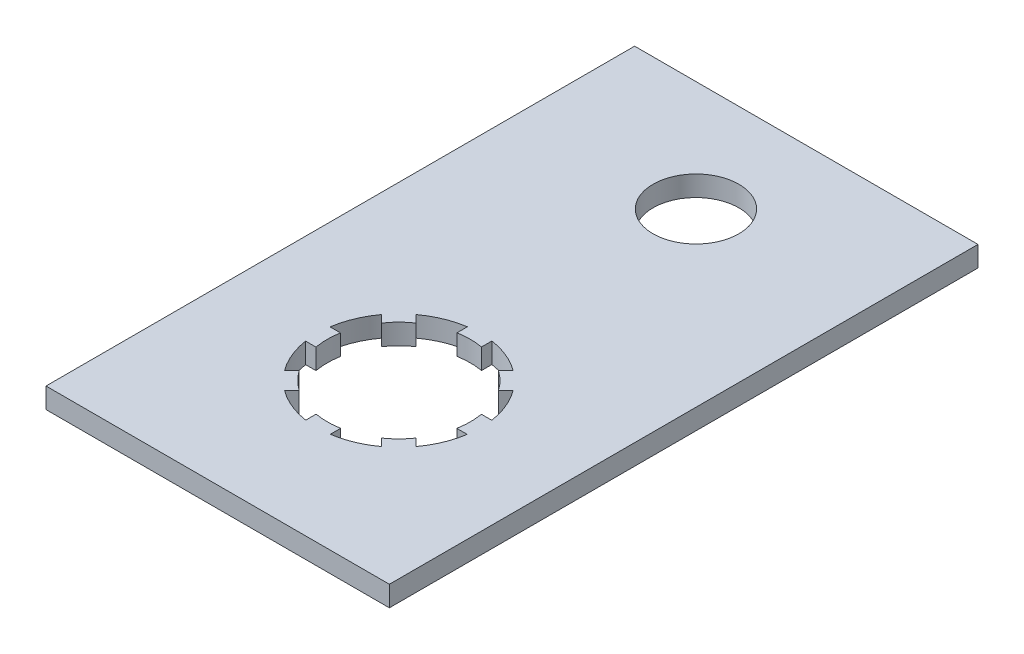
from build123d import *

# Parameters (mm, degrees)
SKETCH1_W           = 21.336
SKETCH1_H           = 36.576
SKETCH1_R           = 2.667
BOSS_EXTRUDE1_DEPTH = 1.27


with BuildPart() as part:
    # Sketch1 → Boss-Extrude1 (new body)
    with BuildSketch(Plane(origin=(0, 0, 0), x_dir=(1, 0, 0), z_dir=(0, 1, 0))):
        Rectangle(SKETCH1_W, SKETCH1_H)
        with BuildLine():
            Line((3.018435283, -2.946661255), (2.56364651, -3.401450028))
            ThreePointArc((2.56364651, -3.401450028), (2.768236135, -3.554896302), (2.963662393, -3.719854635))
            ThreePointArc((2.963662393, -3.719854635), (3.148123637, -3.8946201), (3.322296862, -4.079640655))
            ThreePointArc((3.322296862, -4.079640655), (3.486686927, -4.275669436), (3.639526827, -4.480831181))
            Line((3.639526827, -4.480831181), (4.094539809, -4.025818198))
            ThreePointArc((4.094539809, -4.025818198), (4.696624497, -5.096661904), (5.024040768, -6.280727273))
            Line((5.024040768, -6.280727273), (4.380937187, -6.280727273))
            ThreePointArc((4.380937187, -6.280727273), (4.416928537, -6.533901895), (4.438301261, -6.788727273))
            ThreePointArc((4.438301261, -6.788727273), (4.44498858, -7.042743737), (4.437149708, -7.296727273))
            ThreePointArc((4.437149708, -7.296727273), (4.43430089, -7.340889368), (4.431012547, -7.385020912))
            ThreePointArc((4.431012547, -7.385020912), (4.409221171, -7.595511932), (4.377436347, -7.804727273))
            Line((4.377436347, -7.804727273), (5.020988346, -7.804727273))
            ThreePointArc((5.020988346, -7.804727273), (4.691358526, -8.981399356), (4.090276757, -10.045313694))
            Line((4.090276757, -10.045313694), (3.635376444, -9.590413381))
            ThreePointArc((3.635376444, -9.590413381), (3.480018154, -9.798078789), (3.312813037, -9.996330065))
            ThreePointArc((3.312813037, -9.996330065), (3.138047572, -10.180791309), (2.953027016, -10.354964534))
            ThreePointArc((2.953027016, -10.354964534), (2.759829472, -10.51711401), (2.557745709, -10.668044115))
            Line((2.557745709, -10.668044115), (3.012646022, -11.122944428))
            ThreePointArc((3.012646022, -11.122944428), (1.944031836, -11.725975697), (0.762, -12.055192535))
            Line((0.762, -12.055192535), (0.762, -11.411866343))
            ThreePointArc((0.762, -11.411866343), (0.508842492, -11.448446688), (0.254, -11.470404595))
            ThreePointArc((0.254, -11.470404595), (0, -11.477667672), (-0.254, -11.470404595))
            ThreePointArc((-0.254, -11.470404595), (-0.508842492, -11.448446688), (-0.762, -11.411866343))
            Line((-0.762, -11.411866343), (-0.762, -12.055192535))
            ThreePointArc((-0.762, -12.055192535), (-1.944031836, -11.725975697), (-3.012646022, -11.122944428))
            Line((-3.012646022, -11.122944428), (-2.557745709, -10.668044115))
            ThreePointArc((-2.557745709, -10.668044115), (-2.759829472, -10.51711401), (-2.953027016, -10.354964534))
            ThreePointArc((-2.953027016, -10.354964534), (-3.138047572, -10.180791309), (-3.312813037, -9.996330065))
            ThreePointArc((-3.312813037, -9.996330065), (-3.480018154, -9.798078789), (-3.635376444, -9.590413381))
            Line((-3.635376444, -9.590413381), (-4.090276757, -10.045313694))
            ThreePointArc((-4.090276757, -10.045313694), (-4.691358526, -8.981399356), (-5.020988346, -7.804727273))
            Line((-5.020988346, -7.804727273), (-4.377436347, -7.804727273))
            ThreePointArc((-4.377436347, -7.804727273), (-4.414606192, -7.551586906), (-4.437149708, -7.296727273))
            ThreePointArc((-4.437149708, -7.296727273), (-4.44498858, -7.042743737), (-4.438301261, -6.788727273))
            ThreePointArc((-4.438301261, -6.788727273), (-4.416928537, -6.533901895), (-4.380937187, -6.280727273))
            Line((-4.380937187, -6.280727273), (-5.024040768, -6.280727273))
            ThreePointArc((-5.024040768, -6.280727273), (-4.696624497, -5.096661904), (-4.094539809, -4.025818198))
            Line((-4.094539809, -4.025818198), (-3.639526827, -4.480831181))
            ThreePointArc((-3.639526827, -4.480831181), (-3.486686927, -4.275669436), (-3.322296862, -4.079640655))
            ThreePointArc((-3.322296862, -4.079640655), (-3.148123637, -3.8946201), (-2.963662393, -3.719854635))
            ThreePointArc((-2.963662393, -3.719854635), (-2.768236135, -3.554896302), (-2.56364651, -3.401450028))
            Line((-2.56364651, -3.401450028), (-3.018435283, -2.946661255))
            ThreePointArc((-3.018435283, -2.946661255), (-1.94735447, -2.340737305), (-0.762, -2.010142809))
            Line((-0.762, -2.010142809), (-0.762, -2.653469001))
            ThreePointArc((-0.762, -2.653469001), (-0.508842492, -2.616888656), (-0.254, -2.594930748))
            ThreePointArc((-0.254, -2.594930748), (0, -2.587667672), (0.254, -2.594930748))
            ThreePointArc((0.254, -2.594930748), (0.508842492, -2.616888656), (0.762, -2.653469001))
            Line((0.762, -2.653469001), (0.762, -2.010142809))
            ThreePointArc((0.762, -2.010142809), (1.94735447, -2.340737305), (3.018435283, -2.946661255))
        make_face(mode=Mode.SUBTRACT)
        with Locations(Location((0, 11.43, 0), (0, 0, 270))):
            Circle(SKETCH1_R, mode=Mode.SUBTRACT)
    extrude(amount=BOSS_EXTRUDE1_DEPTH)


solid = part.part
